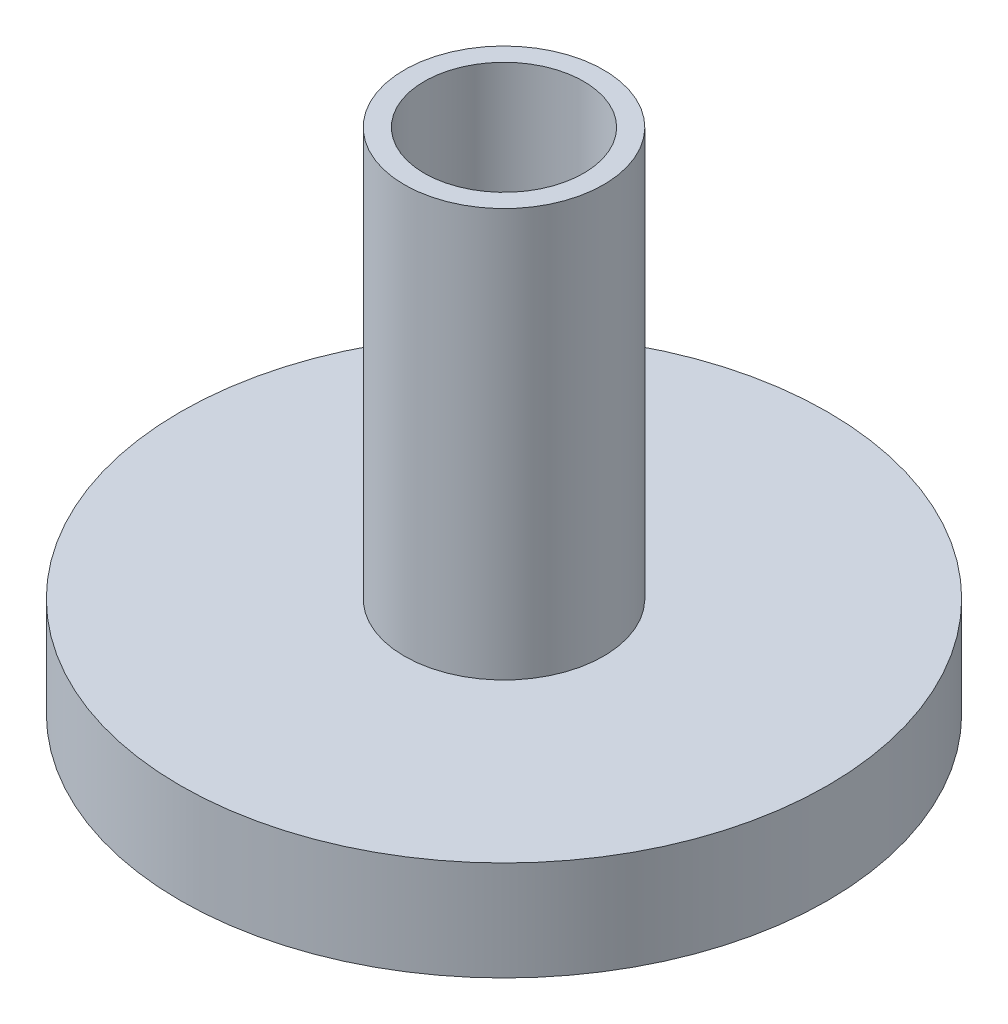
from build123d import *

# Parameters (mm, degrees)
SKETCH1_R           = 6.35
SKETCH1_R_2         = 5.08
BOSS_EXTRUDE1_DEPTH = 26.035
SKETCH2_R           = 20.6375
BOSS_EXTRUDE2_DEPTH = 6.35
SKETCH3_R           = 5.08
BOSS_EXTRUDE3_DEPTH = 15.875


with BuildPart() as part:
    # Sketch1 → Boss-Extrude1 (new body)
    with BuildSketch(Plane(origin=(0, 0, 0), x_dir=(1, 0, 0), z_dir=(0, 1, 0))):
        with Locations(Location((0, 0, 0), (0, 0, 270))):
            Circle(SKETCH1_R)
        with Locations(Location((0, 0, 0), (0, 0, 270))):
            Circle(SKETCH1_R_2, mode=Mode.SUBTRACT)
    extrude(amount=BOSS_EXTRUDE1_DEPTH)

    # Sketch2 → Boss-Extrude2 (add)
    with BuildSketch(Plane.XZ):
        with Locations(Location((0, 0, 0), (0, 0, 270))):
            Circle(SKETCH2_R)
    extrude(amount=BOSS_EXTRUDE2_DEPTH)

    # Sketch3 → Boss-Extrude3 (add)
    with BuildSketch(Plane(origin=(0, 0, 0), x_dir=(1, 0, 0), z_dir=(0, 1, 0))):
        with Locations(Location((0, 0, 0), (0, 0, 270))):
            Circle(SKETCH3_R)
    extrude(amount=BOSS_EXTRUDE3_DEPTH)


solid = part.part
